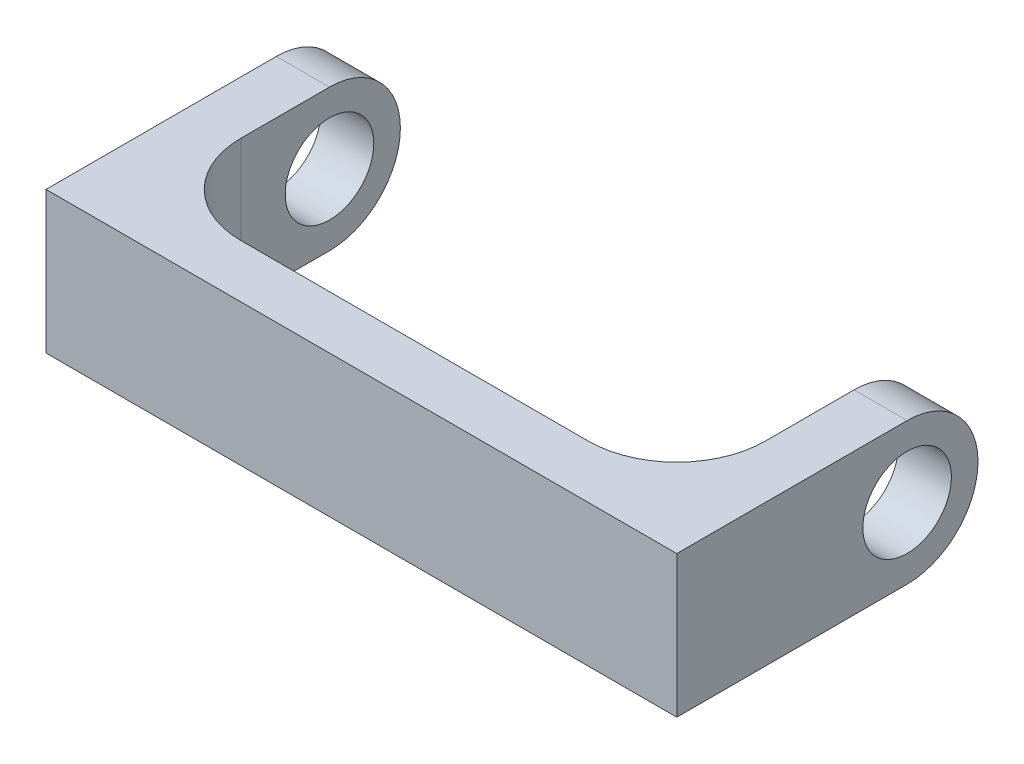
from build123d import *

# Parameters (mm, degrees)
BOSS_EXTRUDE1_START = -0.5
SKETCH2_W           = 3
SKETCH2_H           = 8
SKETCH2_R           = 2.5
BOSS_EXTRUDE1_DEPTH = 3
BOSS_EXTRUDE2_START = 2.5
SKETCH2_3_W         = 3
SKETCH2_3_H         = 8
BOSS_EXTRUDE2_DEPTH = 29.6
BOSS_EXTRUDE3_START = 32.1
SKETCH2_4_W         = 3
SKETCH2_4_H         = 8
SKETCH2_4_R         = 2.5
BOSS_EXTRUDE3_DEPTH = 3
FILLET1_R           = 5


with BuildPart() as part:
    # Sketch2 → Boss-Extrude1 (new body)
    # profile 1 of 2: a face of its own
    with BuildSketch(Plane(origin=(0, 0, 0), x_dir=(0, 0, -1), z_dir=(1, 0, 0)).offset(BOSS_EXTRUDE1_START)):
        with Locations((-11.5, 0)):
            Rectangle(SKETCH2_W, SKETCH2_H)
    # profile 2 of 2: a face of its own
    with BuildSketch(Plane(origin=(0, 0, 0), x_dir=(0, 0, -1), z_dir=(1, 0, 0)).offset(BOSS_EXTRUDE1_START)):
        with BuildLine():
            Line((0, -4), (-10, -4))
            Line((-10, -4), (-10, 4))
            Line((-10, 4), (0, 4))
            ThreePointArc((0, 4), (4, 0), (0, -4))
        make_face()
        Circle(SKETCH2_R, mode=Mode.SUBTRACT)
    extrude(amount=BOSS_EXTRUDE1_DEPTH)

    # Sketch2<3> → Boss-Extrude2 (add)
    with BuildSketch(Plane(origin=(0, 0, 0), x_dir=(0, 0, -1), z_dir=(1, 0, 0)).offset(BOSS_EXTRUDE2_START)):
        with Locations((-11.5, 0)):
            Rectangle(SKETCH2_3_W, SKETCH2_3_H)
    extrude(amount=BOSS_EXTRUDE2_DEPTH)

    # Sketch2<4> → Boss-Extrude3 (add)
    # profile 1 of 2: a face of its own
    with BuildSketch(Plane(origin=(0, 0, 0), x_dir=(0, 0, -1), z_dir=(1, 0, 0)).offset(BOSS_EXTRUDE3_START)):
        with Locations((-11.5, 0)):
            Rectangle(SKETCH2_4_W, SKETCH2_4_H)
    # profile 2 of 2: a face of its own
    with BuildSketch(Plane(origin=(0, 0, 0), x_dir=(0, 0, -1), z_dir=(1, 0, 0)).offset(BOSS_EXTRUDE3_START)):
        with BuildLine():
            Line((0, -4), (-10, -4))
            Line((-10, -4), (-10, 4))
            Line((-10, 4), (0, 4))
            ThreePointArc((0, 4), (4, 0), (0, -4))
        make_face()
        Circle(SKETCH2_4_R, mode=Mode.SUBTRACT)
    extrude(amount=BOSS_EXTRUDE3_DEPTH)

    # Fillet1
    fillet1_edges = [part.edges().sort_by_distance(p)[0] for p in [
        (32.1, 0, 10),
        (2.5, 0, 10),
    ]]
    fillet(fillet1_edges, radius=FILLET1_R)


solid = part.part
